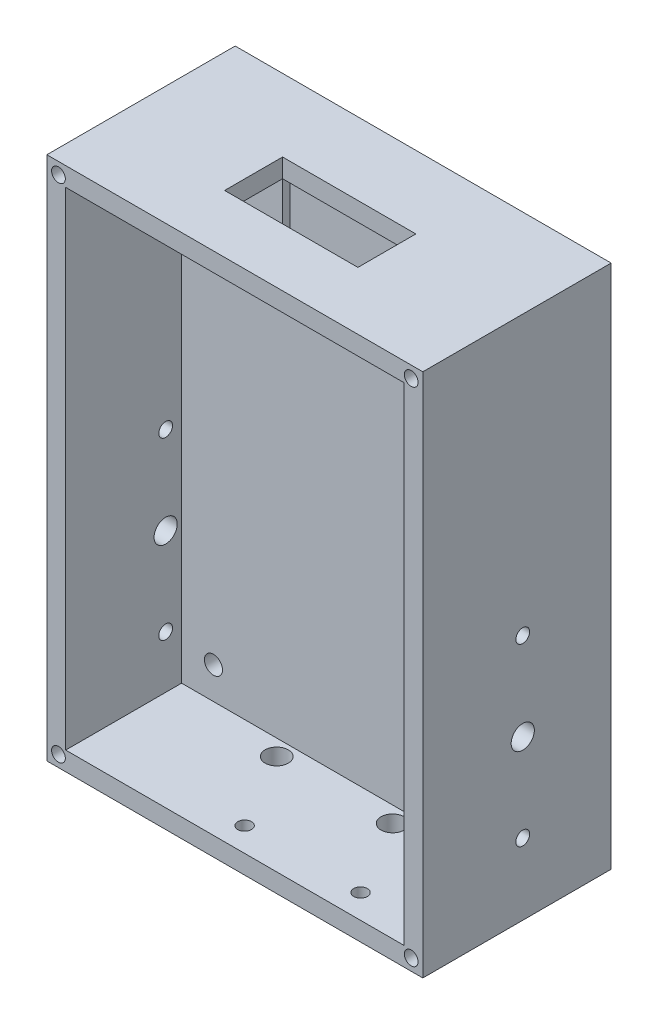
from build123d import *

# Parameters (mm, degrees)
SKETCH_1_W           = 25.95
SKETCH_1_H           = 36.24
EXTRUDE_4_DEPTH      = 5
SKETCH_1_4_W         = 25.95
SKETCH_1_4_H         = 36.24
SKETCH_1_4_W_2       = 23.35
SKETCH_1_4_H_2       = 33.64
EXTRUDE_6_DEPTH      = 13
SKETCH_2_W           = 9.2
SKETCH_2_H           = 4
CUT_EXTRUDE_1_DEPTH  = 2
HOLE_WIZARD_M1_6_1_D = 1.25
SKETCH_5_W           = 9.2
SKETCH_5_H           = 6
CUT_EXTRUDE_2_DEPTH  = 0.5
SKETCH_6_R           = 0.8
CUT_EXTRUDE_3_DEPTH  = 46.039050834
M1_2X0_25_1_D        = 0.95
SKETCH_9_R           = 0.8
CUT_EXTRUDE_4_DEPTH  = 2
M1_2X0_25_2_D        = 0.95
M1_2X0_25_2_DEPTH    = 3.15
M1_2X0_25_2_TIP      = 0.285408794
M1_2X0_25_3_D        = 0.95
M1_2X0_25_3_DEPTH    = 3.15
M1_2X0_25_3_TIP      = 0.285408794


with BuildPart() as part:
    # 草图1 → 凸台-拉伸4 (new body)
    with BuildSketch(Plane.XY):
        with Locations((11.175, 16.32)):
            Rectangle(SKETCH_1_W, SKETCH_1_H)
    extrude(amount=EXTRUDE_4_DEPTH)

    # 草图1<4> → 凸台-拉伸6 (add)
    with BuildSketch(Plane.XY):
        with Locations((11.175, 16.32)):
            Rectangle(SKETCH_1_4_W, SKETCH_1_4_H)
        with Locations((11.175, 16.32)):
            Rectangle(SKETCH_1_4_W_2, SKETCH_1_4_H_2, mode=Mode.SUBTRACT)
    extrude(amount=EXTRUDE_6_DEPTH)

    # 草图2 → 切除-拉伸1 (cut)
    with BuildSketch(Plane(origin=(0, 34.44, 0), x_dir=(1, 0, 0), z_dir=(0, 1, 0))):
        with Locations((11.07, -7)):
            Rectangle(SKETCH_2_W, SKETCH_2_H)
    extrude(amount=-CUT_EXTRUDE_1_DEPTH, mode=Mode.SUBTRACT)

    # M1.6 螺纹孔1 (through all)
    with Locations(Plane.XY.offset(5)):
        with Locations((1.7, 1.7), (20.65, 1.7), (20.65, 30.94), (1.7, 30.94)):
            Hole(HOLE_WIZARD_M1_6_1_D / 2)

    # 草图5 → 切除-拉伸2 (cut)
    with BuildSketch(Plane.XY.offset(5)):
        with Locations((11.07, 30.14)):
            Rectangle(SKETCH_5_W, SKETCH_5_H)
    extrude(amount=-CUT_EXTRUDE_2_DEPTH, mode=Mode.SUBTRACT)

    # 草图6 → 切除-拉伸3 (cut, through all)
    with BuildSketch(Plane(origin=(24.15, 0, 0), x_dir=(0, 0, -1), z_dir=(1, 0, 0))):
        with Locations((-6.1, 9.168)):
            Circle(SKETCH_6_R)
    extrude(amount=-CUT_EXTRUDE_3_DEPTH, mode=Mode.SUBTRACT)

    # M1.2x0.25 螺纹孔1 (through all)
    with Locations(Plane(origin=(24.15, 15.218, 6.1), x_dir=(0, 0, 1), z_dir=(1, 0, 0))):
        with Locations((0, 0), (0, 12.1)):
            Hole(M1_2X0_25_1_D / 2)

    # 草图9 → 切除-拉伸4 (cut)
    with BuildSketch(Plane.XZ.offset(1.8)):
        with Locations((7.166, 6.1)):
            Circle(SKETCH_9_R)
        with Locations((15.166, 6.1)):
            Circle(SKETCH_9_R)
    extrude(amount=-CUT_EXTRUDE_4_DEPTH, mode=Mode.SUBTRACT)

    # M1.2x0.25 螺纹孔2
    with Locations(Plane(origin=(4.141, -1.8, 0.860546307), x_dir=(0, 0, -1), z_dir=(0, -1, 0))):
        with Locations((0, 0), (-10.478907386, 6.05), (0, 8), (-10.478907386, 14.05)):
            Hole(M1_2X0_25_2_D / 2, depth=M1_2X0_25_2_DEPTH)
            with Locations((0, 0, -(M1_2X0_25_2_DEPTH + M1_2X0_25_2_TIP / 2))):  # 118° drill point
                Cone(0, M1_2X0_25_2_D / 2, M1_2X0_25_2_TIP, mode=Mode.SUBTRACT)

    # M1.2x0.25 螺纹孔3
    with Locations(Plane(origin=(-1, 33.64, 13), x_dir=(1, 0, 0), z_dir=(0, 0, 1))):
        with Locations((0, 0), (24.35, 0), (0, -34.64), (24.35, -34.64)):
            Hole(M1_2X0_25_3_D / 2, depth=M1_2X0_25_3_DEPTH)
            with Locations((0, 0, -(M1_2X0_25_3_DEPTH + M1_2X0_25_3_TIP / 2))):  # 118° drill point
                Cone(0, M1_2X0_25_3_D / 2, M1_2X0_25_3_TIP, mode=Mode.SUBTRACT)


solid = part.part
